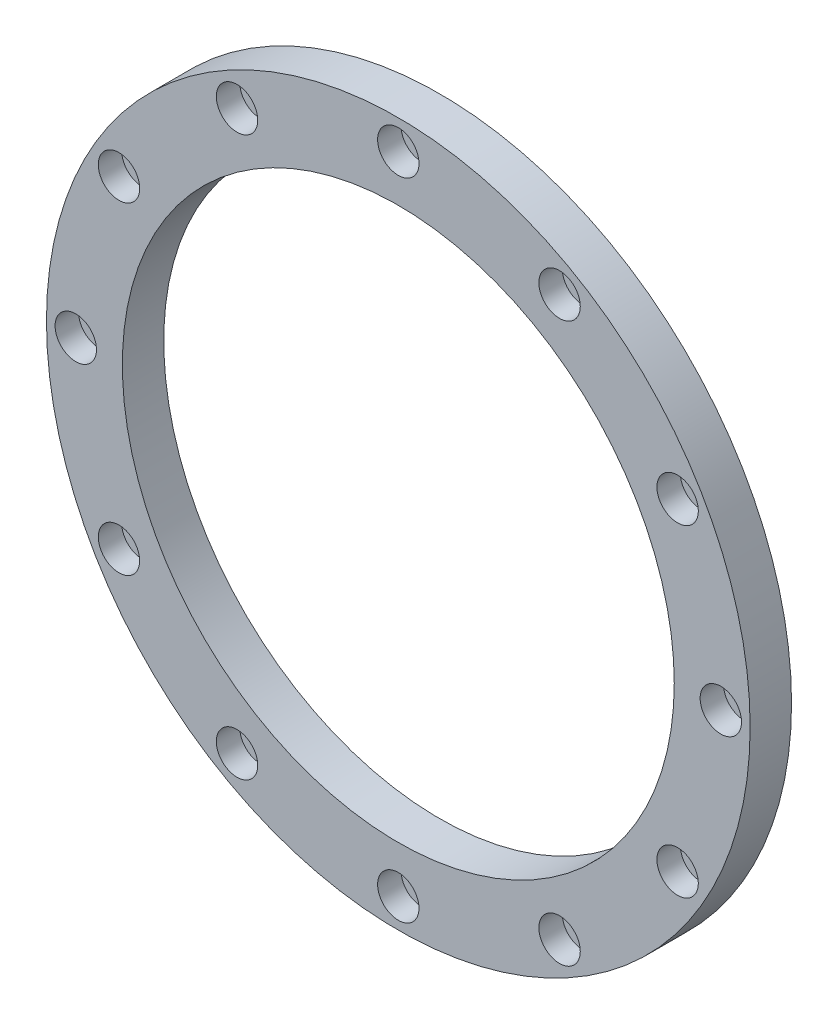
from build123d import *

# Parameters (mm, degrees)
SKETCH_1_R                = 51
EXTRUDE_1_DEPTH           = 6
HOLE_WIZARD_1_D           = 3.4
HOLE_WIZARD_1_CBORE_D     = 6
HOLE_WIZARD_1_CBORE_DEPTH = 3.4
SKETCH_4_R                = 40
CUT_EXTRUDE_1_DEPTH       = 73.374028491
PATTERN_CIRCULAR_1_COUNT  = 12


with BuildPart() as part:
    # 草图1 → 凸台-拉伸1 (new body)
    with BuildSketch(Plane.XY):
        Circle(SKETCH_1_R)
    extrude(amount=EXTRUDE_1_DEPTH)

    # 打孔尺寸(%根据)内六角圆柱头螺钉的类型1 (through all)
    with Locations(Plane.XY.offset(6)):
        with Locations((0, 46.75)):
            hole_wizard_1 = CounterBoreHole(HOLE_WIZARD_1_D / 2, HOLE_WIZARD_1_CBORE_D / 2, HOLE_WIZARD_1_CBORE_DEPTH)

    # 草图4 → 切除-拉伸1 (cut, through all)
    with BuildSketch(Plane.XY.offset(6)):
        Circle(SKETCH_4_R)
    extrude(amount=-CUT_EXTRUDE_1_DEPTH, mode=Mode.SUBTRACT)

    # 阵列(圆周)1: 打孔尺寸(%根据)内六角圆柱头螺钉的类型1 ×12 about axis
    pattern_circular_1_axis = Axis((0, 0, 0), (0, 0, 1))
    for i in range(1, PATTERN_CIRCULAR_1_COUNT):
        add(hole_wizard_1.rotate(pattern_circular_1_axis, i * 360 / PATTERN_CIRCULAR_1_COUNT), mode=Mode.SUBTRACT)


solid = part.part
